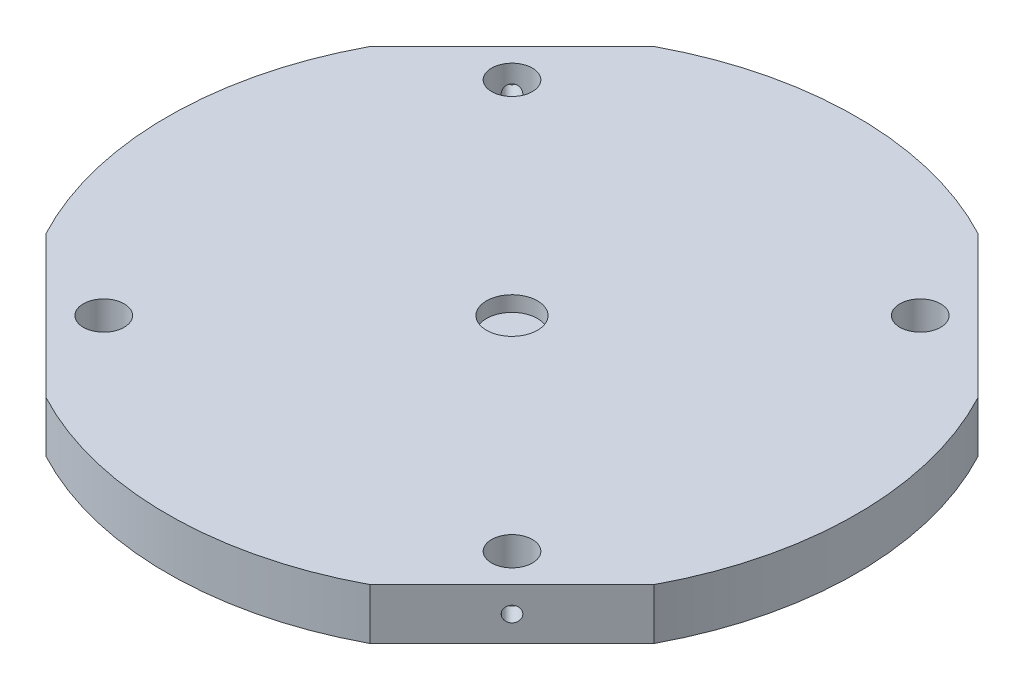
from build123d import *

# Parameters (mm, degrees)
SKETCH1_R                  = 67.5
BOSS_EXTRUDE1_DEPTH        = 10
CUT_EXTRUDE1_DEPTH         = 96.981769102
CUT_EXTRUDE1_DEPTH_BACK    = 96.981769102
SKETCH4_R                  = 4
CUT_EXTRUDE_THIN1_DEPTH    = 96.981769102
F_3_0MM_DOWEL_HOLE1_REACH  = 162.34
F_3_0MM_DOWEL_HOLE1_BORE_R = 1.5
CIRPATTERN1_COUNT          = 4
CUT_EXTRUDE2_DEPTH         = 96.981769113
CUT_EXTRUDE2_DEPTH_BACK    = 3
SKETCH8_R                  = 5


with BuildPart() as part:
    # Sketch1 → Boss-Extrude1 (new body)
    with BuildSketch(Plane(origin=(0, 0, 0), x_dir=(1, 0, 0), z_dir=(0, 1, 0))):
        with Locations(Location((0, 0, 0), (0, 0, 270))):
            Circle(SKETCH1_R)
    extrude(amount=BOSS_EXTRUDE1_DEPTH)

    # Sketch4 → Cut-Extrude1 (cut, two sides: drawn at the far end of the back side and taken through both)
    with BuildSketch(Plane(origin=(0, 10, 0), x_dir=(1, 0, 0), z_dir=(0, 1, 0)).offset(-CUT_EXTRUDE1_DEPTH_BACK)):
        with Locations(Location((-40, 40, 0), (0, 0, 270))):
            Circle(SKETCH4_R)
        with Locations(Location((40, 40, 0), (0, 0, 270))):
            Circle(SKETCH4_R)
        with Locations(Location((40, -40, 0), (0, 0, 270))):
            Circle(SKETCH4_R)
        with Locations(Location((-40, -40, 0), (0, 0, 270))):
            Circle(SKETCH4_R)
    extrude(amount=CUT_EXTRUDE1_DEPTH + CUT_EXTRUDE1_DEPTH_BACK, mode=Mode.SUBTRACT)

    # Sketch5 → Cut-Extrude-Thin1 (cut, through all)
    with BuildSketch(Plane(origin=(0, 10, 0), x_dir=(1, 0, 0), z_dir=(0, 1, 0))):
        Polygon((-31.743671291, 59.570037208), (-59.570037208, 31.743671291), (-66.64110502, 38.814739103), (-38.814739103, 66.64110502), align=None)
        Polygon((59.570037208, 31.743671291), (31.743671291, 59.570037208), (38.814739103, 66.64110502), (66.64110502, 38.814739103), align=None)
        Polygon((31.743671291, -59.570037208), (59.570037208, -31.743671291), (66.64110502, -38.814739103), (38.814739103, -66.64110502), align=None)
        Polygon((-59.570037208, -31.743671291), (-31.743671291, -59.570037208), (-38.814739103, -66.64110502), (-66.64110502, -38.814739103), align=None)
    extrude(amount=-CUT_EXTRUDE_THIN1_DEPTH, mode=Mode.SUBTRACT)

    # Ø3.0mm Dowel Hole1 bore → Ø3.0mm Dowel Hole1 (cut, up to next)
    with BuildSketch(Plane(origin=(45.656854249, 0, 45.656854249), x_dir=(0.7071067811865479, 0, -0.7071067811865471), z_dir=(0.7071067811865471, 0, 0.7071067811865479)), mode=Mode.PRIVATE) as f_3_0mm_dowel_hole1_sk1:
        with Locations((0, 5)):
            Circle(F_3_0MM_DOWEL_HOLE1_BORE_R)
    f_3_0mm_dowel_hole1_tool1 = extrude(f_3_0mm_dowel_hole1_sk1.sketch, amount=-F_3_0MM_DOWEL_HOLE1_REACH, mode=Mode.PRIVATE) & part.part
    f_3_0mm_dowel_hole1 = f_3_0mm_dowel_hole1_tool1.solids().sort_by_distance((45.656854, 5, 45.656854))[0]
    add(f_3_0mm_dowel_hole1, mode=Mode.SUBTRACT)

    # CirPattern1: Ø3.0mm Dowel Hole1 ×4 about axis
    cirpattern1_axis = Axis((0, 10, 0), (0, -1, 0))
    for i in range(1, CIRPATTERN1_COUNT):
        add(f_3_0mm_dowel_hole1.rotate(cirpattern1_axis, i * 360 / CIRPATTERN1_COUNT), mode=Mode.SUBTRACT)

    # Sketch8 → Cut-Extrude2 (cut, two sides: drawn at the far end of the back side and taken through both)
    with BuildSketch(Plane(origin=(0, 10, 0), x_dir=(1, 0, 0), z_dir=(0, 1, 0)).offset(-CUT_EXTRUDE2_DEPTH_BACK)):
        with Locations(Location((0, 0, 0), (0, 0, 90))):
            Circle(SKETCH8_R)
    extrude(amount=CUT_EXTRUDE2_DEPTH + CUT_EXTRUDE2_DEPTH_BACK, mode=Mode.SUBTRACT)


solid = part.part
